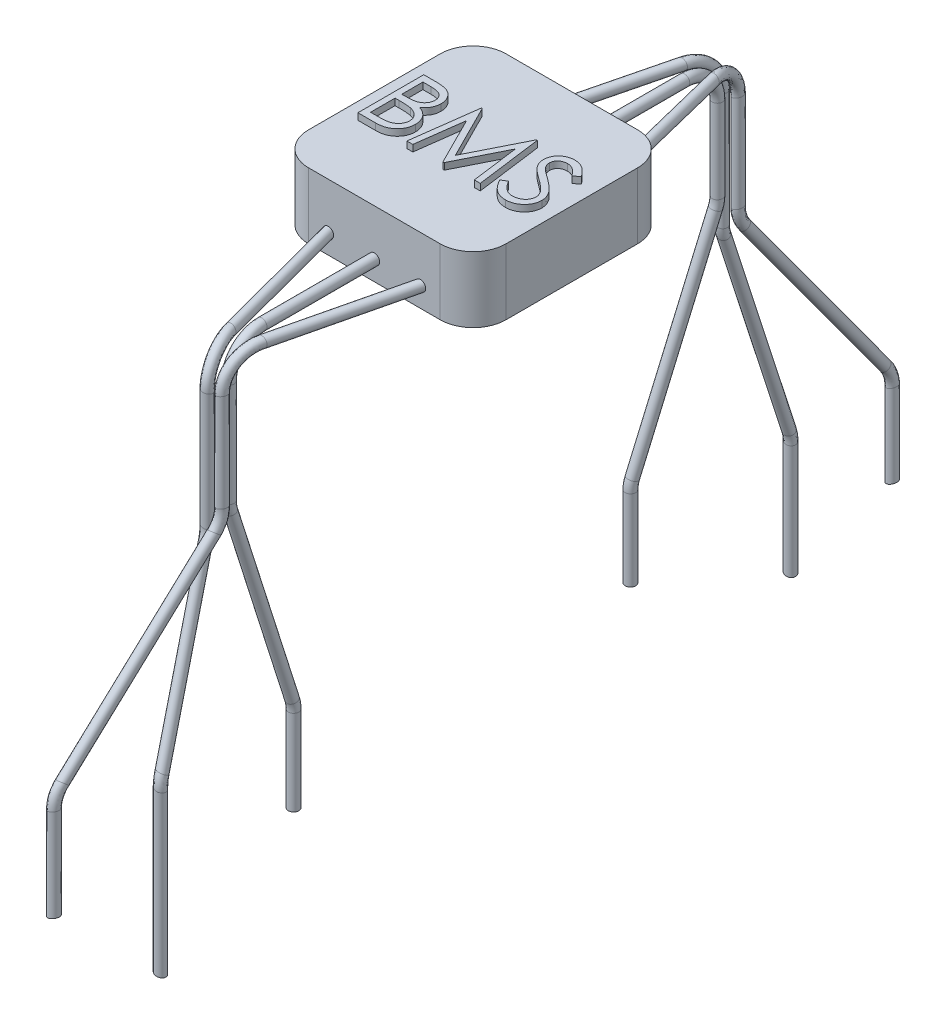
from build123d import *

# Parameters (mm, degrees)
BOSS_EXTRUDE1_DEPTH = 10
BOSS_EXTRUDE2_DEPTH = 1
SKETCH3_R           = 0.8
SKETCH7_R           = 0.8
SKETCH8_R           = 0.8
SKETCH9_R           = 0.8
SKETCH10_R          = 0.8
SKETCH11_R          = 0.8


with BuildPart() as part:
    # Sketch1 → Boss-Extrude1 (new body)
    with BuildSketch(Plane(origin=(0, 0, 0), x_dir=(1, 0, 0), z_dir=(0, 1, 0))):
        with BuildLine():
            Line((-10, -15), (10, -15))
            ThreePointArc((10, -15), (13.535533906, -13.535533906), (15, -10))
            Line((15, -10), (15, 10))
            ThreePointArc((15, 10), (13.535533906, 13.535533906), (10, 15))
            Line((10, 15), (-10, 15))
            ThreePointArc((-10, 15), (-13.535533906, 13.535533906), (-15, 10))
            Line((-15, 10), (-15, -10))
            ThreePointArc((-15, -10), (-13.535533906, -13.535533906), (-10, -15))
        make_face()
    extrude(amount=BOSS_EXTRUDE1_DEPTH)

    # Sketch2 → Boss-Extrude2 (add)
    # profile 1 of 3: a face of its own
    with BuildSketch(Plane(origin=(0, 10, 0), x_dir=(1, 0, 0), z_dir=(0, 1, 0))):
        with BuildLine():
            Line((-12.5, 5), (-10.548878205, 5))
            add(Edge.make_bspline(
                [(-10.548878205, 5), (-10.453368267, 4.999497856), (-10.268246238, 4.998524576), (-9.999047833, 4.983429916), (-9.746908374, 4.962848002), (-9.511754738, 4.930190594), (-9.293695589, 4.890785516), (-9.092073768, 4.843066042), (-8.907530419, 4.785847146), (-8.687208315, 4.694857771), (-8.436006426, 4.559648718), (-8.164011019, 4.359852818), (-7.931427478, 4.115474352), (-7.730895143, 3.839809622), (-7.571463372, 3.53656456), (-7.456122523, 3.212966878), (-7.383100022, 2.873190472), (-7.37559021, 2.63992425), (-7.371794872, 2.522035256)],
                knots=[0, 0, 0, 0, 1.001505555, 1.941167018, 2.826882275, 3.653841531, 4.429895133, 5.150066043, 5.825578002, 6.45369114, 7.647487171, 8.808567382, 9.977351308, 11.170798116, 12.373658725, 13.556498008, 14.765093433, 16, 16, 16, 16], degree=3))
            add(Edge.make_bspline(
                [(-7.371794872, 2.522035256), (-7.374918353, 2.411599383), (-7.381056288, 2.194582477), (-7.439749886, 1.877170736), (-7.531637511, 1.575024397), (-7.659366794, 1.289246153), (-7.825372497, 1.026292972), (-8.022110551, 0.784043641), (-8.259472843, 0.572754907), (-8.437310672, 0.454632328), (-8.527644231, 0.39463141)],
                knots=[0, 0, 0, 0, 1.044552857, 2.05264487, 3.044412934, 4.028983338, 5.005914585, 5.980388656, 6.974128949, 8, 8, 8, 8], degree=3))
            add(Edge.make_bspline(
                [(-8.527644231, 0.39463141), (-8.414043009, 0.351017128), (-8.196695731, 0.267572201), (-7.897592838, 0.120042304), (-7.639893281, -0.040420869), (-7.421615721, -0.215654727), (-7.234936707, -0.404537043), (-7.071928303, -0.609837369), (-6.932838662, -0.834233821), (-6.81365888, -1.075386779), (-6.720662435, -1.330833831), (-6.651016994, -1.598178906), (-6.611109996, -1.876463349), (-6.605431021, -2.065850147), (-6.602564103, -2.161458333)],
                knots=[0, 0, 0, 0, 1.27268992, 2.434971085, 3.483601985, 4.442670788, 5.356604649, 6.2567628, 7.179492994, 8.113709626, 9.066344395, 10.018646069, 10.999752585, 12, 12, 12, 12], degree=3))
            add(Edge.make_bspline(
                [(-6.602564103, -2.161458333), (-6.605355091, -2.259077968), (-6.61084644, -2.451147334), (-6.651360645, -2.733304861), (-6.719958093, -3.002947566), (-6.814447083, -3.261819516), (-6.937767982, -3.509419901), (-7.08784788, -3.746029226), (-7.266795204, -3.969270171), (-7.46697483, -4.18162338), (-7.693438103, -4.372559915), (-7.937768831, -4.542604791), (-8.203044031, -4.682450683), (-8.484906871, -4.79992503), (-8.786519203, -4.889659883), (-9.106526652, -4.952438666), (-9.444653229, -4.994738771), (-9.676681089, -4.9982165), (-9.795673077, -5)],
                knots=[0, 0, 0, 0, 0.978564426, 1.925352924, 2.850884081, 3.763762016, 4.682927383, 5.618979971, 6.567305752, 7.547517671, 8.540179244, 9.531824382, 10.526200242, 11.540722885, 12.589160233, 13.674978461, 14.80764778, 16, 16, 16, 16], degree=3))
            Line((-9.795673077, -5), (-12.5, -5))
            Line((-12.5, -5), (-12.5, 5))
        make_face()
        with BuildLine():
            Line((-11.602564103, 3.974358974), (-11.602564103, 0.769230769))
            Line((-11.602564103, 0.769230769), (-10.999599359, 0.769230769))
            add(Edge.make_bspline(
                [(-10.999599359, 0.769230769), (-10.911459944, 0.770373406), (-10.741156631, 0.772581214), (-10.494528356, 0.778905549), (-10.265599732, 0.796614244), (-10.054765923, 0.81431785), (-9.862358941, 0.843102386), (-9.688805051, 0.877365595), (-9.531380488, 0.913602466), (-9.349838929, 0.975229572), (-9.143916219, 1.066308644), (-8.924393065, 1.207656747), (-8.730866009, 1.376012042), (-8.567445472, 1.570271932), (-8.433698414, 1.784175321), (-8.340802085, 2.014309265), (-8.277809844, 2.254938213), (-8.272119755, 2.420133221), (-8.269230769, 2.50400641)],
                knots=[0, 0, 0, 0, 1.156816544, 2.235205308, 3.236616184, 4.169592532, 5.011045266, 5.787822928, 6.49130361, 7.128639758, 8.301311294, 9.436451833, 10.541879658, 11.654887649, 12.756523258, 13.837046038, 14.901820046, 16, 16, 16, 16], degree=3))
            add(Edge.make_bspline(
                [(-8.269230769, 2.50400641), (-8.270734141, 2.559508615), (-8.273683169, 2.668382249), (-8.297835463, 2.82709469), (-8.338885675, 2.976362554), (-8.391612227, 3.118231441), (-8.465294195, 3.248265298), (-8.552046947, 3.370960143), (-8.656863205, 3.482137625), (-8.776169813, 3.586050477), (-8.913337307, 3.678177699), (-9.068283855, 3.758865594), (-9.243105789, 3.823839242), (-9.434856804, 3.880742534), (-9.646488482, 3.920709088), (-9.875558635, 3.954004482), (-10.123943546, 3.970955173), (-10.295786696, 3.973199067), (-10.384615385, 3.974358974)],
                knots=[0, 0, 0, 0, 0.91205012, 1.789085906, 2.630437955, 3.453916878, 4.269457761, 5.079663411, 5.91843418, 6.774407191, 7.675494373, 8.627863946, 9.638891023, 10.736472738, 11.911756761, 13.175263542, 14.539845004, 16, 16, 16, 16], degree=3))
            Line((-10.384615385, 3.974358974), (-11.602564103, 3.974358974))
        make_face(mode=Mode.SUBTRACT)
        with BuildLine():
            Line((-11.602564103, -0.256410256), (-11.602564103, -3.974358974))
            Line((-11.602564103, -3.974358974), (-10.324519231, -3.974358974))
            add(Edge.make_bspline(
                [(-10.324519231, -3.974358974), (-10.233036585, -3.973262553), (-10.056715847, -3.971149346), (-9.802140903, -3.964250619), (-9.566189178, -3.948558402), (-9.349937362, -3.923855975), (-9.151050354, -3.897060406), (-8.97191406, -3.861028175), (-8.811076364, -3.81974543), (-8.624578342, -3.75593351), (-8.414568319, -3.656800735), (-8.188251586, -3.507331517), (-7.98703382, -3.329264924), (-7.816161651, -3.123176597), (-7.676124541, -2.899087092), (-7.574251812, -2.661528949), (-7.511420793, -2.414427442), (-7.503814595, -2.245951121), (-7.5, -2.161458333)],
                knots=[0, 0, 0, 0, 1.160039823, 2.235823828, 3.228722157, 4.157150951, 4.99529583, 5.772374946, 6.472645482, 7.099169577, 8.269452708, 9.405989375, 10.527446681, 11.663510218, 12.788923519, 13.866172445, 14.929861265, 16, 16, 16, 16], degree=3))
            add(Edge.make_bspline(
                [(-7.5, -2.161458333), (-7.50078887, -2.108620218), (-7.502353884, -2.00379627), (-7.525955641, -1.849751072), (-7.560280983, -1.700534291), (-7.604656509, -1.555740747), (-7.669283557, -1.417988243), (-7.744730829, -1.284552359), (-7.833191977, -1.155256703), (-7.97103245, -0.991793122), (-8.171523835, -0.803458799), (-8.456400336, -0.619065936), (-8.780321187, -0.470357915), (-9.015256881, -0.407216554), (-9.13661859, -0.374599359)],
                knots=[0, 0, 0, 0, 0.723448775, 1.435228256, 2.130040452, 2.821711965, 3.505591119, 4.210454504, 4.921174351, 5.648778258, 7.137944449, 8.670945889, 10.280296675, 12, 12, 12, 12], degree=3))
            add(Edge.make_bspline(
                [(-9.13661859, -0.374599359), (-9.185273149, -0.364727691), (-9.29076627, -0.343323877), (-9.462787929, -0.320730439), (-9.659176126, -0.300601696), (-9.880384346, -0.285712674), (-10.126692464, -0.27032255), (-10.398626517, -0.264337347), (-10.695075988, -0.257196604), (-10.90076848, -0.256679077), (-11.007612179, -0.256410256)],
                knots=[0, 0, 0, 0, 0.634451884, 1.375622551, 2.216452059, 3.157844607, 4.20941857, 5.370758133, 6.634282058, 8, 8, 8, 8], degree=3))
            Line((-11.007612179, -0.256410256), (-11.602564103, -0.256410256))
        make_face(mode=Mode.SUBTRACT)
    # profile 2 of 3: a face of its own
    with BuildSketch(Plane(origin=(0, 10, 0), x_dir=(1, 0, 0), z_dir=(0, 1, 0))):
        Polygon((-5.064102564, -5), (-3.743990385, 5), (-3.615785256, 5), (0.512820513, -3.205128205), (4.631410256, 5), (4.76161859, 5), (6.08974359, -5), (5.188301282, -5), (4.230769231, 2.195512821), (0.62099359, -5), (0.418669872, -5), (-3.205128205, 2.211538462), (-4.160657051, -5), align=None)
    # profile 3 of 3: a face of its own
    with BuildSketch(Plane(origin=(0, 10, 0), x_dir=(1, 0, 0), z_dir=(0, 1, 0))):
        with BuildLine():
            Line((7.115384615, -3.070913462), (7.960737179, -2.564102564))
            add(Edge.make_bspline(
                [(7.960737179, -2.564102564), (8.039360714, -2.695715093), (8.190000373, -2.947879618), (8.441289971, -3.288616876), (8.701669717, -3.578223039), (8.973067813, -3.815013346), (9.253827665, -4.001438736), (9.545782104, -4.133445113), (9.847947278, -4.215776471), (10.053586767, -4.225776718), (10.15625, -4.230769231)],
                knots=[0, 0, 0, 0, 1.272034388, 2.437168799, 3.508375237, 4.49857839, 5.41946034, 6.295179144, 7.148887113, 8, 8, 8, 8], degree=3))
            add(Edge.make_bspline(
                [(10.15625, -4.230769231), (10.243926744, -4.228327309), (10.417746096, -4.223486194), (10.673638219, -4.176969617), (10.922157654, -4.105506392), (11.158182333, -4.003160873), (11.378455517, -3.879336628), (11.571617504, -3.729776121), (11.738606399, -3.562329819), (11.875203869, -3.375522234), (11.98000397, -3.174616095), (12.060552737, -2.968399091), (12.105252947, -2.753631753), (12.111986528, -2.609030431), (12.115384615, -2.536057692)],
                knots=[0, 0, 0, 0, 1.095163259, 2.171163733, 3.241058638, 4.321873601, 5.38011039, 6.391990106, 7.366004449, 8.327778327, 9.272591725, 10.192022065, 11.087607919, 12, 12, 12, 12], degree=3))
            add(Edge.make_bspline(
                [(12.115384615, -2.536057692), (12.111172299, -2.452798122), (12.102609276, -2.283543581), (12.030233618, -2.033830287), (11.916378627, -1.786708658), (11.811342502, -1.6338479), (11.756810897, -1.554487179)],
                knots=[0, 0, 0, 0, 0.938893495, 1.908633276, 2.914225137, 4, 4, 4, 4], degree=3))
            add(Edge.make_bspline(
                [(11.756810897, -1.554487179), (11.712037714, -1.497210541), (11.618042016, -1.376965402), (11.456449123, -1.197979015), (11.266831654, -1.013354961), (11.055678639, -0.816043369), (10.815298386, -0.615221093), (10.553219773, -0.401311728), (10.262751605, -0.182450079), (10.059038757, -0.03567132), (9.953926282, 0.040064103)],
                knots=[0, 0, 0, 0, 0.722233717, 1.516239348, 2.393582979, 3.351407094, 4.387010283, 5.505090956, 6.712668013, 8, 8, 8, 8], degree=3))
            add(Edge.make_bspline(
                [(9.953926282, 0.040064103), (9.848714864, 0.115002924), (9.647558646, 0.258280245), (9.36624841, 0.470921057), (9.114692802, 0.665332112), (8.894009897, 0.843343575), (8.704296764, 1.004979589), (8.544058446, 1.148687987), (8.417376855, 1.278355303), (8.346932338, 1.362473423), (8.315304487, 1.400240385)],
                knots=[0, 0, 0, 0, 1.452282411, 2.77665338, 3.964542531, 5.026858415, 5.96415736, 6.766646006, 7.446254459, 8, 8, 8, 8], degree=3))
            add(Edge.make_bspline(
                [(8.315304487, 1.400240385), (8.271097215, 1.45910049), (8.184157682, 1.574856786), (8.069397666, 1.755784951), (7.971857201, 1.940994281), (7.895393395, 2.130982466), (7.831004198, 2.323082262), (7.787695825, 2.519800107), (7.760577548, 2.720253303), (7.757800443, 2.855149019), (7.756410256, 2.922676282)],
                knots=[0, 0, 0, 0, 1.068054152, 2.10047183, 3.106115577, 4.101338837, 5.06977816, 6.043150881, 7.020423561, 8, 8, 8, 8], degree=3))
            add(Edge.make_bspline(
                [(7.756410256, 2.922676282), (7.760139425, 3.028475638), (7.767518054, 3.237812963), (7.829919532, 3.543615336), (7.928413513, 3.835576528), (8.066398907, 4.110806053), (8.244277059, 4.362137427), (8.4501227, 4.592461675), (8.695298375, 4.786086196), (8.96430587, 4.955263505), (9.258752647, 5.087680435), (9.567298085, 5.187568949), (9.890432577, 5.244166828), (10.109298676, 5.252289014), (10.220352564, 5.256410256)],
                knots=[0, 0, 0, 0, 1.005424448, 1.989358655, 2.955360095, 3.929531133, 4.905563448, 5.876582895, 6.856512386, 7.866279853, 8.892233794, 9.918561126, 10.94386622, 12, 12, 12, 12], degree=3))
            add(Edge.make_bspline(
                [(10.220352564, 5.256410256), (10.338192851, 5.252345823), (10.57253957, 5.244262963), (10.917251614, 5.173984302), (11.249139376, 5.057696668), (11.516120132, 4.925729074), (11.725070879, 4.793925029), (11.884421544, 4.673868388), (12.045899975, 4.535653792), (12.210808703, 4.378913089), (12.376353444, 4.202208086), (12.544991879, 4.006748975), (12.717118362, 3.793730244), (12.82784939, 3.641660242), (12.884615385, 3.563701923)],
                knots=[0, 0, 0, 0, 1.286793592, 2.559021753, 3.825965368, 5.121522368, 5.803751409, 6.523245864, 7.299691795, 8.125521123, 9.008227632, 9.944561021, 10.946284179, 12, 12, 12, 12], degree=3))
            Line((12.884615385, 3.563701923), (12.073317308, 2.948717949))
            add(Edge.make_bspline(
                [(12.073317308, 2.948717949), (12.024328929, 3.011828493), (11.929988766, 3.133364645), (11.786761661, 3.303568404), (11.651765524, 3.45904406), (11.518764382, 3.594087282), (11.394782577, 3.716093378), (11.274448171, 3.820549826), (11.159492882, 3.908480098), (11.014587423, 4.002318841), (10.832536799, 4.095337423), (10.604009553, 4.174049074), (10.365191624, 4.221349251), (10.202535534, 4.227603216), (10.120192308, 4.230769231)],
                knots=[0, 0, 0, 0, 1.181633172, 2.275549214, 3.290209073, 4.226197932, 5.078386478, 5.862611352, 6.581680152, 7.217281963, 8.414376989, 9.595101626, 10.782541182, 12, 12, 12, 12], degree=3))
            add(Edge.make_bspline(
                [(10.120192308, 4.230769231), (10.016887958, 4.227307231), (9.817675251, 4.22063109), (9.534846005, 4.147716847), (9.280291933, 4.032911531), (9.061570319, 3.872011594), (8.87946467, 3.681380186), (8.747734788, 3.462012029), (8.668448604, 3.219776593), (8.658773519, 3.050800432), (8.653846154, 2.96474359)],
                knots=[0, 0, 0, 0, 1.14458467, 2.207223713, 3.21896685, 4.227309161, 5.202851033, 6.127160689, 7.046193047, 8, 8, 8, 8], degree=3))
            add(Edge.make_bspline(
                [(8.653846154, 2.96474359), (8.654969373, 2.911167937), (8.657217647, 2.803929024), (8.688574212, 2.64549639), (8.728858009, 2.487463992), (8.7926941, 2.330542326), (8.880823539, 2.171987015), (8.996552613, 2.009067765), (9.142304933, 1.840348597), (9.25395354, 1.730613243), (9.312900641, 1.672676282)],
                knots=[0, 0, 0, 0, 0.858281714, 1.717966888, 2.583508476, 3.4729293, 4.427298488, 5.488583878, 6.674047936, 8, 8, 8, 8], degree=3))
            add(Edge.make_bspline(
                [(9.312900641, 1.672676282), (9.334790276, 1.653141923), (9.38679504, 1.606732756), (9.481869113, 1.530754811), (9.607419965, 1.437032605), (9.760169112, 1.321068843), (9.942933002, 1.18655038), (10.155731734, 1.035197203), (10.396193256, 0.862095891), (10.566827302, 0.741074346), (10.657051282, 0.677083333)],
                knots=[0, 0, 0, 0, 0.420754252, 0.999615792, 1.744751191, 2.668019286, 3.750313428, 4.999500688, 6.413464383, 8, 8, 8, 8], degree=3))
            add(Edge.make_bspline(
                [(10.657051282, 0.677083333), (10.765582463, 0.59810802), (10.975738053, 0.445183272), (11.274759709, 0.215424187), (11.545884875, -0.009283724), (11.790065457, -0.227505458), (12.009713767, -0.437585724), (12.202392969, -0.642051953), (12.370066341, -0.839439304), (12.550578394, -1.092503806), (12.735029307, -1.403306904), (12.893433614, -1.784101871), (12.993314607, -2.166377072), (13.006376079, -2.423310891), (13.012820513, -2.550080128)],
                knots=[0, 0, 0, 0, 1.163667725, 2.253281268, 3.268753668, 4.215851969, 5.092017293, 5.902905408, 6.650798638, 7.335211899, 8.59617414, 9.77448103, 10.901945474, 12, 12, 12, 12], degree=3))
            add(Edge.make_bspline(
                [(13.012820513, -2.550080128), (13.010942975, -2.6397326), (13.007224361, -2.817296553), (12.964478893, -3.078025344), (12.901851278, -3.3312564), (12.807459181, -3.573859579), (12.692250158, -3.810273186), (12.546060878, -4.034295759), (12.37661035, -4.250885469), (12.182228165, -4.454266873), (11.969525587, -4.64097029), (11.74471503, -4.807053323), (11.507428536, -4.945534247), (11.258953346, -5.058536653), (10.999232384, -5.146918131), (10.728353001, -5.2109549), (10.445868684, -5.250256932), (10.253867308, -5.25433625), (10.15625, -5.256410256)],
                knots=[0, 0, 0, 0, 0.983748083, 1.948392443, 2.894712957, 3.844097841, 4.80183111, 5.778335162, 6.776009319, 7.81870978, 8.863265674, 9.881300176, 10.883814829, 11.87499822, 12.874611388, 13.892143829, 14.928324115, 16, 16, 16, 16], degree=3))
            add(Edge.make_bspline(
                [(10.15625, -5.256410256), (10.080720449, -5.254949738), (9.930612563, -5.252047094), (9.708585472, -5.226386292), (9.491043788, -5.190080282), (9.280717268, -5.132440082), (9.074896092, -5.062505862), (8.874475422, -4.97639634), (8.679358125, -4.873204336), (8.488450746, -4.755218552), (8.302238818, -4.61791071), (8.12246891, -4.457986434), (7.943242666, -4.27985642), (7.769850105, -4.078683382), (7.598783978, -3.857717431), (7.433417094, -3.614891193), (7.270326472, -3.351527325), (7.167996564, -3.166198508), (7.115384615, -3.070913462)],
                knots=[0, 0, 0, 0, 0.915332311, 1.819136955, 2.706846663, 3.586547465, 4.459518054, 5.340707479, 6.227863349, 7.133153174, 8.059268498, 9.028702269, 10.047606654, 11.120612155, 12.245963614, 13.433783089, 14.680604001, 16, 16, 16, 16], degree=3))
        make_face()
    extrude(amount=BOSS_EXTRUDE2_DEPTH)

    # Sweep1: sweep along a curve in space
    with BuildLine() as sweep1_path:
        Line((6.967025267, 3.005549844, 14.822152292), (2.266149947, 3.005549844, 34.436969707))
        ThreePointArc((2.266149947, 3.005549844, 34.436969707), (1.442159276, 1.54108375, 37.87514355), (1.100851164, -1.994450156, 39.299281785))
        Line((1.100851164, -1.994450156, 39.299281785), (1.100851164, -16.795258131, 39.299281785))
        ThreePointArc((1.100851164, -16.795258131, 39.299281785), (1.047358064, -18.415056131, 39.563567883), (0.892648432, -19.860145685, 40.327920762))
        Line((0.892648432, -19.860145685, 40.327920762), (-2.992532941, -45.103339256, 59.522908988))
        ThreePointArc((-2.992532941, -45.103339256, 59.522908988), (-3.147242573, -46.54842881, 60.287261867), (-3.200735673, -48.16822681, 60.551547965))
        Line((-3.200735673, -48.16822681, 60.551547965), (-3.200735673, -62.2, 60.551547965))
    # Sketch3 → Sweep1 (sweep)
    with BuildSketch(Plane.XY.offset(15)):
        with Locations((7, 3)):
            Circle(SKETCH3_R)
    sweep(path=sweep1_path.line)

    # Sweep2: sweep along a curve in space
    with BuildLine() as sweep2_path:
        Line((0, 3, 15), (0, 3, 32.107002278))
        ThreePointArc((0, -2, 37.107002278), (0, 1.535533906, 35.642536183), (0, 3, 32.107002278))
        Line((0, -2, 37.107002278), (0, -17.710594066, 37.107002278))
        ThreePointArc((0, -17.710594066, 37.107002278), (0.005126136, -18.43620697, 37.054319498), (0.020396011, -19.146456738, 36.897386591))
        Line((0.020396011, -19.146456738, 36.897386591), (0.851499747, -47.771600207, 28.355893924))
        ThreePointArc((0.851499747, -47.771600207, 28.355893924), (0.866769622, -48.481849975, 28.198961017), (0.871895758, -49.20746288, 28.146278237))
        Line((0.871895758, -49.20746288, 28.146278237), (0.871895758, -62.2, 28.146278237))
    # Sketch7 → Sweep2 (sweep)
    with BuildSketch(Plane.XY.offset(15)):
        with Locations((0, 3)):
            Circle(SKETCH7_R)
    sweep(path=sweep2_path.line)

    # Sweep4: sweep along a curve in space
    with BuildLine() as sweep4_path:
        Line((-7, 3, 15), (-2.343205503, 2.341317159, 34.473872454))
        ThreePointArc((-1.218573155, -2.655979596, 39.176881555), (-1.545760415, 0.820946754, 37.808643602), (-2.343205503, 2.341317159, 34.473872454))
        Line((-1.218573155, -2.655979596, 39.176881555), (-1.218573155, -20.499165772, 39.176881555))
        ThreePointArc((-1.218573155, -20.499165772, 39.176881555), (-1.189480262, -21.482965397, 39.270192897), (-1.103339017, -22.428301798, 39.546478765))
        Line((-1.103339017, -22.428301798, 39.546478765), (1.884765862, -46.432928535, 49.13040279))
        ThreePointArc((1.884765862, -46.432928535, 49.13040279), (1.970907107, -47.378264935, 49.406688658), (2, -48.36206456, 49.5))
        Line((2, -48.36206456, 49.5), (2, -72.7, 49.5))
    # Sketch8 → Sweep4 (sweep)
    with BuildSketch(Plane.XY.offset(15)):
        with Locations((-7, 3)):
            Circle(SKETCH8_R)
    sweep(path=sweep4_path.line)

    # Sweep5: sweep along a curve in space
    with BuildLine() as sweep5_path:
        Line((7, 3, -15), (2.177788774, 3, -34.429027616))
        ThreePointArc((0.973350814, -2, -39.281792724), (1.326122525, 1.535533906, -37.860450732), (2.177788774, 3, -34.429027616))
        Line((0.973350814, -2, -39.281792724), (0.973350814, -16.671413013, -39.281792724))
        ThreePointArc((1.075176123, -19.576929239, -40.207057422), (0.999428831, -18.196905368, -39.518758056), (0.973350814, -16.671413013, -39.281792724))
        Line((1.075176123, -19.576929239, -40.207057422), (3.193406516, -46.696189166, -59.454961777))
        ThreePointArc((3.193406516, -46.696189166, -59.454961777), (3.269153808, -48.076213037, -60.143261143), (3.295231825, -49.601705391, -60.380226475))
        Line((3.295231825, -49.601705391, -60.380226475), (3.295231825, -62.2, -60.380226475))
    # Sketch9 → Sweep5 (sweep)
    with BuildSketch(Plane(origin=(0, 0, -15), x_dir=(-1, 0, 0), z_dir=(0, 0, -1))):
        with Locations((-7, 3)):
            Circle(SKETCH9_R)
    sweep(path=sweep5_path.line)

    # Sweep6: sweep along a curve in space
    with BuildLine() as sweep6_path:
        Line((0, 3, -15), (0, 3, -32.120087203))
        ThreePointArc((0, -2, -37.120087203), (0, 1.535533906, -35.655621109), (0, 3, -32.120087203))
        Line((0, -2, -37.120087203), (0, -14.71231622, -37.120087203))
        ThreePointArc((0, -14.71231622, -37.120087203), (-0.017067709, -15.468584908, -37.06515237), (-0.067878107, -16.207451809, -36.901611925))
        Line((-0.067878107, -16.207451809, -36.901611925), (-3.064491489, -48.437604918, -27.25658829))
        ThreePointArc((-3.064491489, -48.437604918, -27.25658829), (-3.115301887, -49.17647182, -27.093047845), (-3.132369596, -49.932740508, -27.038113012))
        Line((-3.132369596, -49.932740508, -27.038113012), (-3.132369596, -62.2, -27.038113012))
    # Sketch10 → Sweep6 (sweep)
    with BuildSketch(Plane(origin=(0, 0, -15), x_dir=(-1, 0, 0), z_dir=(0, 0, -1))):
        with Locations((0, 3)):
            Circle(SKETCH10_R)
    sweep(path=sweep6_path.line)

    # Sweep7: sweep along a curve in space
    with BuildLine() as sweep7_path:
        Line((-7, 3, -15), (-2.270922361, 3, -34.032479038))
        ThreePointArc((-1.065214401, -2, -38.884928761), (-1.418358086, 1.535533906, -37.463679142), (-2.270922361, 3, -34.032479038))
        Line((-1.065214401, -2, -38.884928761), (-1.065214401, -19.782226884, -38.884928761))
        ThreePointArc((-1.065214401, -21.320722335, -39.127510159), (-1.065214401, -20.560978126, -38.945946426), (-1.065214401, -19.782226884, -38.884928761))
        Line((-1.065214401, -21.320722335, -39.127510159), (-1.065214401, -52.014450535, -49.053515239))
        ThreePointArc((-1.065214401, -53.552945986, -49.296096638), (-1.065214401, -52.774194744, -49.235078972), (-1.065214401, -52.014450535, -49.053515239))
        Line((-1.065214401, -53.552945986, -49.296096638), (-1.065214401, -70.881003393, -49.296096638))
    # Sketch11 → Sweep7 (sweep)
    with BuildSketch(Plane(origin=(0, 0, -15), x_dir=(-1, 0, 0), z_dir=(0, 0, -1))):
        with Locations((7, 3)):
            Circle(SKETCH11_R)
    sweep(path=sweep7_path.line)


solid = part.part
